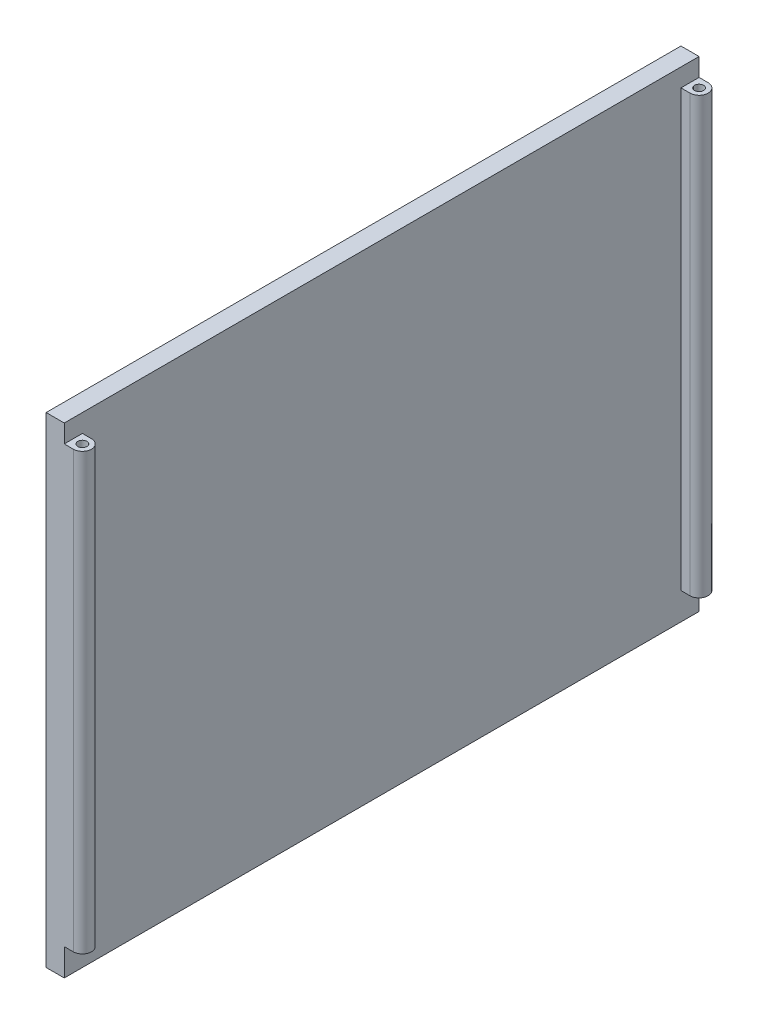
from build123d import *

# Parameters (mm, degrees)
SKETCH_1_W      = 70
SKETCH_1_H      = 53
EXTRUDE_1_DEPTH = 2
EXTRUDE_START   = 3
SKETCH_2_R      = 0.5
EXTRUDE_2_DEPTH = 48
SKETCH_3_R      = 0.5
EXTRUDE_3_DEPTH = 2.5


with BuildPart() as part:
    # Эскиз1 → Бобышка-Вытянуть1 (new body)
    with BuildSketch(Plane(origin=(0, 0, 0), x_dir=(0, 0, -1), z_dir=(1, 0, 0))):
        with Locations((0, 26.5)):
            Rectangle(SKETCH_1_W, SKETCH_1_H)
    extrude(amount=EXTRUDE_1_DEPTH)

    # Эскиз2 → Бобышка-Вытянуть2 (add)
    with BuildSketch(Plane(origin=(0, 0, 0), x_dir=(1, 0, 0), z_dir=(0, 1, 0)).offset(EXTRUDE_START)):
        with BuildLine():
            Line((2, 35), (3, 35))
            ThreePointArc((3, 35), (4, 34), (3, 33))
            Line((3, 33), (2, 33))
            Line((2, 33), (2, 35))
        make_face()
        with Locations(Location((3, 34, 0), (0, 0, 270))):
            Circle(SKETCH_2_R, mode=Mode.SUBTRACT)
    extrude_2 = extrude(amount=EXTRUDE_2_DEPTH)

    # Зеркальное отражение1: Бобышка-Вытянуть2 across plane
    add(extrude_2.mirror(Plane.XY))

    # Эскиз3 → Бобышка-Вытянуть3 (add, symmetric)
    with BuildSketch(Plane.XY):
        with BuildLine():
            Line((-1, 29), (0, 29))
            Line((0, 29), (0, 27))
            Line((0, 27), (-1, 27))
            ThreePointArc((-1, 27), (-2, 28), (-1, 29))
        make_face()
        with Locations((-1, 28)):
            Circle(SKETCH_3_R, mode=Mode.SUBTRACT)
    extrude(amount=EXTRUDE_3_DEPTH, both=True)


solid = part.part
